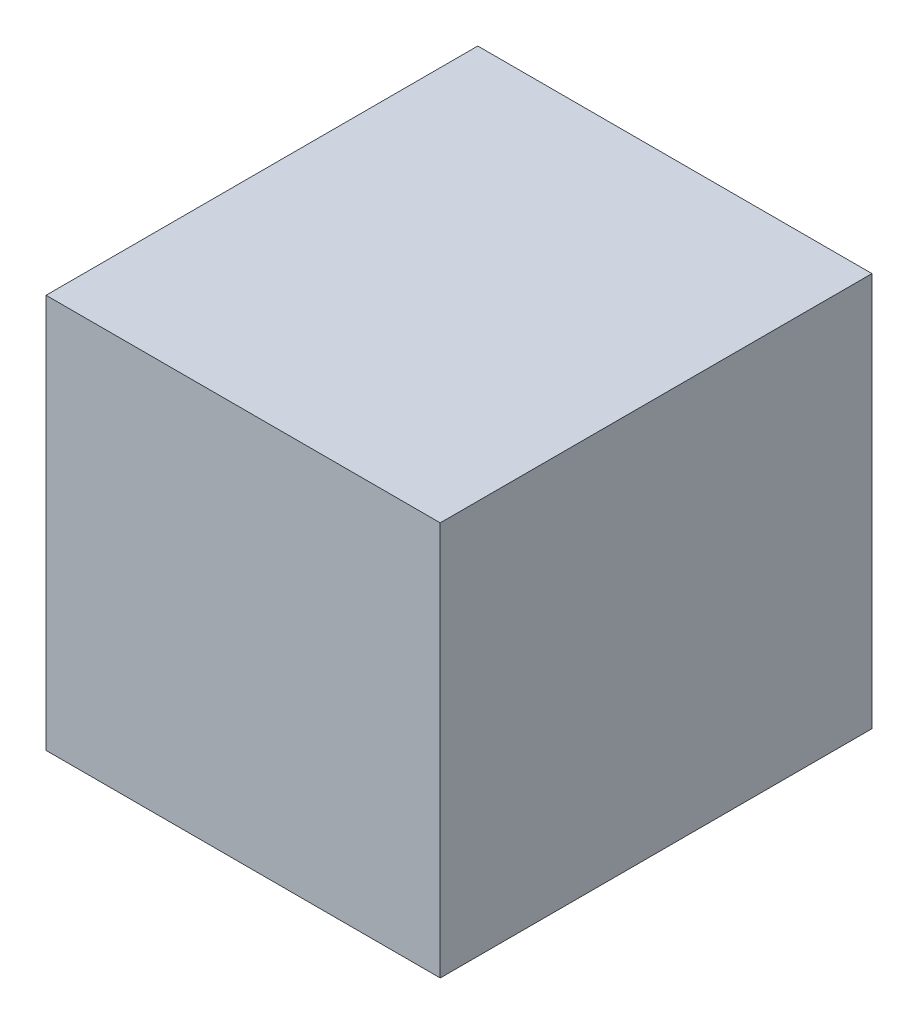
from build123d import *

# Parameters (mm, degrees)
ESQUISSE1_W        = 105
ESQUISSE1_H        = 105
BOSS_EXTRU_1_DEPTH = 115


with BuildPart() as part:
    # Esquisse1 → Boss.-Extru.1 (new body)
    with BuildSketch(Plane.XY):
        Rectangle(ESQUISSE1_W, ESQUISSE1_H)
    extrude(amount=BOSS_EXTRU_1_DEPTH)


solid = part.part
